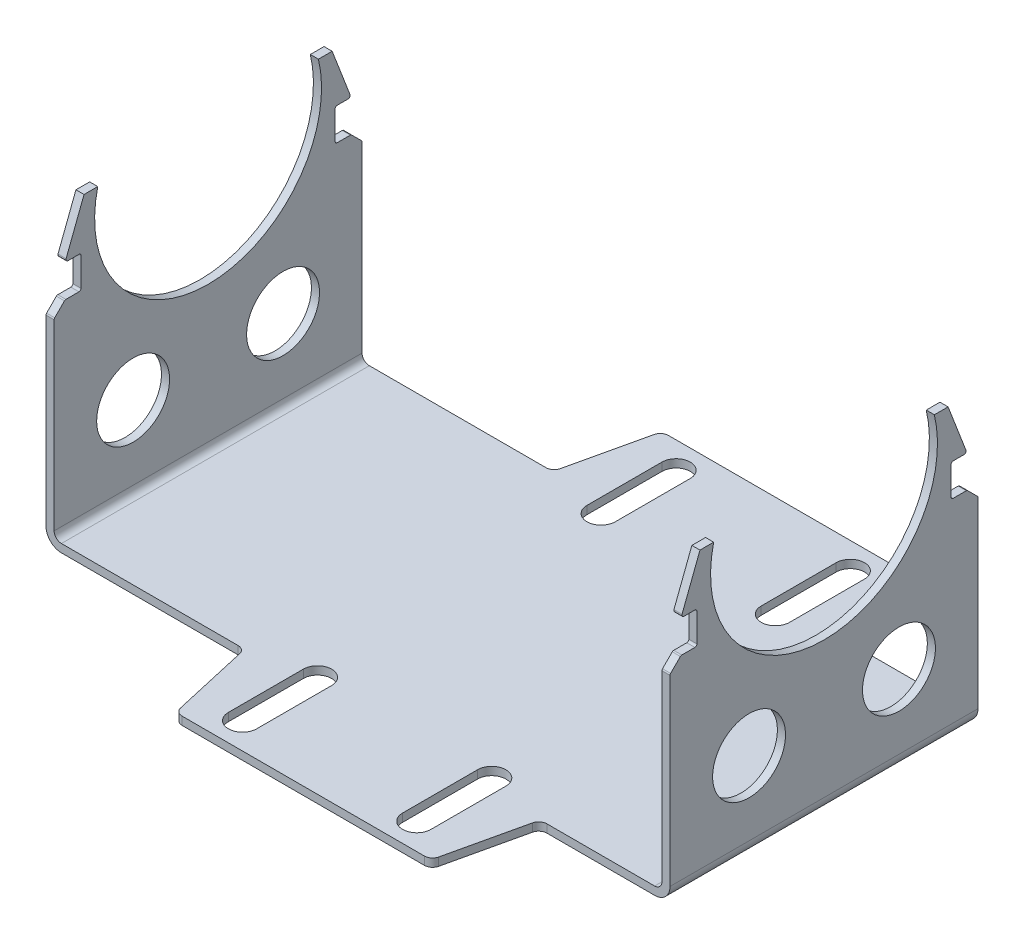
from build123d import *

# Parameters (mm, degrees)
EXTRUDE_1_DEPTH     = 2
SKETCH_3_W          = 2
SKETCH_3_H          = 76
EXTRUDE_2_DEPTH     = 70
SKETCH_5_R          = 28
CUT_EXTRUDE_1_DEPTH = 209.086520467
FILLET_1_R          = 0.5
FILLET_2_R          = 1.8
FILLET_3_R          = 3.8
FILLET_4_R          = 2
SKETCH_6_R          = 9
CUT_EXTRUDE_2_DEPTH = 209.086520467
CUT_EXTRUDE_3_DEPTH = 10


with BuildPart() as part:
    # Эскиз1 → Бобышка-Вытянуть1 (new body)
    with BuildSketch(Plane(origin=(0, 0, 0), x_dir=(1, 0, 0), z_dir=(0, 1, 0))):
        Polygon((52, 0), (115, 0), (120, 22), (152, 22), (152, 98), (120, 98), (115, 120), (52, 120), (47, 98), (-2, 98), (-2, 22), (47, 22), align=None)
    extrude(amount=EXTRUDE_1_DEPTH)

    # Эскиз3 → Бобышка-Вытянуть2 (add)
    with BuildSketch(Plane(origin=(0, 2, 0), x_dir=(1, 0, 0), z_dir=(0, 1, 0))):
        with Locations((-1, 60)):
            Rectangle(SKETCH_3_W, SKETCH_3_H)
        with Locations((151, 60)):
            Rectangle(SKETCH_3_W, SKETCH_3_H)
    extrude(amount=EXTRUDE_2_DEPTH)

    # Эскиз5 → Вырез-Вытянуть1 (cut, through all)
    with BuildSketch(Plane.ZY.offset(2)):
        with Locations((-60, 65.477437004)):
            Circle(SKETCH_5_R)
        Polygon((-95.299672715, 59.821425916), (-91.361232517, 59.821425916), (-91.361232517, 51.821425916), (-95.299672715, 51.821425916), (-98, 49.121098631), (-98, 72), (-90.614846418, 72), align=None)
        Polygon((-22, 72), (-22, 49.121098631), (-24.700327285, 51.821425916), (-28.638767483, 51.821425916), (-28.638767483, 59.821425916), (-24.700327285, 59.821425916), (-29.385153582, 72), align=None)
    extrude(amount=-CUT_EXTRUDE_1_DEPTH, mode=Mode.SUBTRACT)

    # Скругление1
    fillet_1_edges = [part.edges().sort_by_distance(p)[0] for p in [
        (-1, 49.121098631, -22),
        (151, 49.121098631, -22),
        (-1, 51.821425916, -24.700327285),
        (151, 51.821425916, -24.700327285),
        (-1, 51.821425916, -28.638767483),
        (151, 51.821425916, -28.638767483),
        (-1, 59.821425916, -28.638767483),
        (151, 59.821425916, -28.638767483),
        (-1, 59.821425916, -24.700327285),
        (151, 59.821425916, -24.700327285),
        (-1, 59.821425916, -95.299672715),
        (151, 59.821425916, -95.299672715),
        (-1, 59.821425916, -91.361232517),
        (151, 59.821425916, -91.361232517),
        (-1, 51.821425916, -91.361232517),
        (151, 51.821425916, -91.361232517),
        (-1, 51.821425916, -95.299672715),
        (151, 51.821425916, -95.299672715),
        (-1, 49.121098631, -98),
        (151, 49.121098631, -98),
    ]]
    fillet(fillet_1_edges, radius=FILLET_1_R)

    # Скругление2
    fillet_2_edges = [part.edges().sort_by_distance(p)[0] for p in [
        (0, 2, -60),
        (150, 2, -60),
    ]]
    fillet(fillet_2_edges, radius=FILLET_2_R)

    # Скругление3
    fillet_3_edges = [part.edges().sort_by_distance(p)[0] for p in [
        (152, 0, -60),
        (-2, 0, -60),
    ]]
    fillet(fillet_3_edges, radius=FILLET_3_R)

    # Скругление4
    fillet_4_edges = [part.edges().sort_by_distance(p)[0] for p in [
        (115, 1, -120),
        (120, 1, -98),
        (120, 1, -22),
        (115, 1, 0),
        (52, 1, 0),
        (47, 1, -22),
        (47, 1, -98),
        (52, 1, -120),
    ]]
    fillet(fillet_4_edges, radius=FILLET_4_R)

    # Эскиз6 → Вырез-Вытянуть2 (cut, through all)
    with BuildSketch(Plane.ZY.offset(2)):
        with Locations((-78.5, 22)):
            Circle(SKETCH_6_R)
        with Locations((-41.5, 22)):
            Circle(SKETCH_6_R)
    extrude(amount=-CUT_EXTRUDE_2_DEPTH, mode=Mode.SUBTRACT)

    # Эскиз7 → Вырез-Вытянуть3 (cut)
    with BuildSketch(Plane(origin=(0, 2, 0), x_dir=(1, 0, 0), z_dir=(0, 1, 0))):
        with BuildLine():
            Line((65.5, 25), (65.5, 6.5))
            ThreePointArc((65.5, 6.5), (62, 3), (58.5, 6.5))
            Line((58.5, 6.5), (58.5, 25))
            ThreePointArc((58.5, 25), (62, 28.5), (65.5, 25))
        make_face()
        with BuildLine():
            Line((108.5, 25), (108.5, 6.5))
            ThreePointArc((108.5, 6.5), (105, 3), (101.5, 6.5))
            Line((101.5, 6.5), (101.5, 25))
            ThreePointArc((101.5, 25), (105, 28.5), (108.5, 25))
        make_face()
        with BuildLine():
            Line((101.5, 95), (101.5, 113.5))
            ThreePointArc((101.5, 113.5), (105, 117), (108.5, 113.5))
            Line((108.5, 113.5), (108.5, 95))
            ThreePointArc((108.5, 95), (105, 91.5), (101.5, 95))
        make_face()
        with BuildLine():
            Line((58.5, 95), (58.5, 113.5))
            ThreePointArc((58.5, 113.5), (62, 117), (65.5, 113.5))
            Line((65.5, 113.5), (65.5, 95))
            ThreePointArc((65.5, 95), (62, 91.5), (58.5, 95))
        make_face()
    extrude(amount=-CUT_EXTRUDE_3_DEPTH, mode=Mode.SUBTRACT)


solid = part.part
